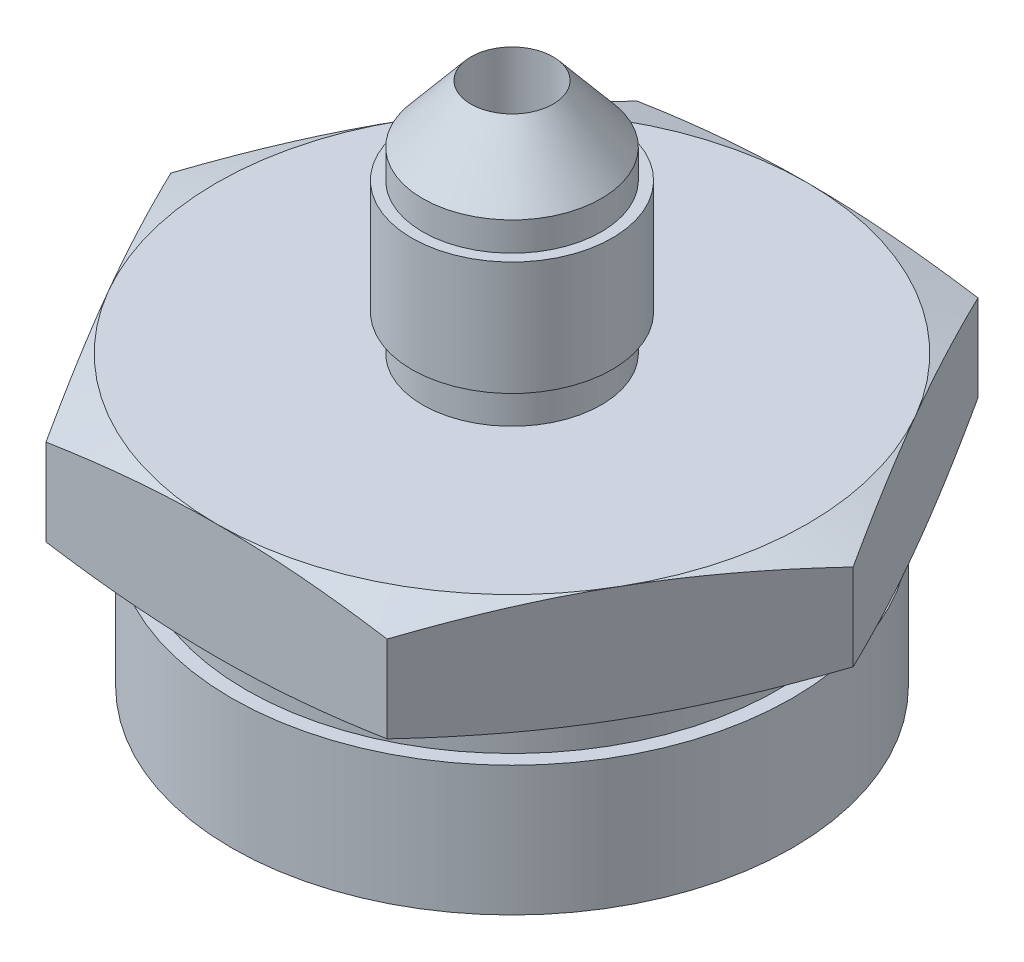
from build123d import *

# Parameters (mm, degrees)
EXTRUDE_1_DEPTH     = 20
SKETCH_3_OUTSIDE_W  = 62.49
SKETCH_3_OUTSIDE_H  = 56.148
SKETCH_3_OUTSIDE_R  = 18.45
CUT_EXTRUDE_1_DEPTH = 12
SKETCH_11_R         = 16.7
CUT_EXTRUDE_2_DEPTH = 1.5
SKETCH_13_R         = 15
CUT_EXTRUDE_4_DEPTH = 17
SKETCH_14_R         = 15.7
CUT_EXTRUDE_5_DEPTH = 13.5
SKETCH_15_W         = 1
SKETCH_15_H         = 9
SKETCH_16_R         = 6.2
EXTRUDE_2_DEPTH     = 2.5
SKETCH_17_R         = 6.95
EXTRUDE_3_DEPTH     = 7.9
SKETCH_18_R         = 6.2
EXTRUDE_4_DEPTH     = 2
SKETCH_21_R         = 2.85
CUT_EXTRUDE_6_DEPTH = 49.016073698


with BuildPart() as part:
    # Эскиз2 → Бобышка-Вытянуть1 (new body)
    with BuildSketch(Plane(origin=(0, 0, 0), x_dir=(1, 0, 0), z_dir=(0, 1, 0))):
        Polygon((11.835680518, -20.5), (23.671361037, 0), (11.835680518, 20.5), (-11.835680518, 20.5), (-23.671361037, 0), (-11.835680518, -20.5), align=None)
    extrude(amount=EXTRUDE_1_DEPTH)

    # Эскиз3 outside → Вырез-Вытянуть1 (cut)
    with BuildSketch(Plane.XZ):
        Rectangle(SKETCH_3_OUTSIDE_W, SKETCH_3_OUTSIDE_H)
        with Locations(Location((0, 0, 0), (0, 0, 270))):
            Circle(SKETCH_3_OUTSIDE_R, mode=Mode.SUBTRACT)
    extrude(amount=-CUT_EXTRUDE_1_DEPTH, mode=Mode.SUBTRACT)

    # Эскиз10 → Вырез-Повернуть1 (revolve, cut)
    with BuildSketch(Plane.XY):
        Polygon((23.671361037, 20), (23.671361037, 19), (20.5, 20), align=None)
    cut_revolve_1 = revolve(axis=Axis((0, 12, 0), (0, -1, 0)), mode=Mode.SUBTRACT)

    # Зеркальное отражение1: Вырез-Повернуть1 across plane
    add(cut_revolve_1.mirror(Plane(origin=(0, 16, 0), x_dir=(0, 0, 1), z_dir=(0, -1, 0))), mode=Mode.SUBTRACT)

    # Эскиз11 → Вырез-Вытянуть2 (cut)
    with BuildSketch(Plane.XZ):
        with Locations(Location((0, 0, 0), (0, 0, 270))):
            Circle(SKETCH_11_R)
    extrude(amount=-CUT_EXTRUDE_2_DEPTH, mode=Mode.SUBTRACT)

    # Эскиз13 → Вырез-Вытянуть4 (cut)
    with BuildSketch(Plane.XZ):
        with Locations(Location((0, 0, 0), (0, 0, 270))):
            Circle(SKETCH_13_R)
    extrude(amount=-CUT_EXTRUDE_4_DEPTH, mode=Mode.SUBTRACT)

    # Эскиз14 → Вырез-Вытянуть5 (cut)
    with BuildSketch(Plane(origin=(0, 3.5, 0), x_dir=(-1, 0, 0), z_dir=(0, -1, 0))):
        with Locations(Location((0, 0, 0), (0, 0, 90))):
            Circle(SKETCH_14_R)
    extrude(amount=-CUT_EXTRUDE_5_DEPTH, mode=Mode.SUBTRACT)

    # Эскиз15 → Повернуть1 (revolve)
    with BuildSketch(Plane.XY, mode=Mode.PRIVATE) as revolve_1_sk:
        with Locations((18.95, 4.5)):
            Rectangle(SKETCH_15_W, SKETCH_15_H)
    revolve(revolve_1_sk.sketch.rotate(Axis((0, 17, 0), (0, -1, 0)), 90), axis=Axis((0, 17, 0), (0, -1, 0)))

    # Эскиз16 → Бобышка-Вытянуть2 (add)
    with BuildSketch(Plane(origin=(0, 20, 0), x_dir=(1, 0, 0), z_dir=(0, 1, 0))):
        with Locations(Location((0, 0, 0), (0, 0, 270))):
            Circle(SKETCH_16_R)
    extrude(amount=EXTRUDE_2_DEPTH)

    # Эскиз17 → Бобышка-Вытянуть3 (add)
    with BuildSketch(Plane(origin=(0, 22.5, 0), x_dir=(1, 0, 0), z_dir=(0, 1, 0))):
        with Locations(Location((0, 0, 0), (0, 0, 270))):
            Circle(SKETCH_17_R)
    extrude(amount=EXTRUDE_3_DEPTH)

    # Эскиз18 → Бобышка-Вытянуть4 (add)
    with BuildSketch(Plane(origin=(0, 30.4, 0), x_dir=(1, 0, 0), z_dir=(0, 1, 0))):
        with Locations(Location((0, 0, 0), (0, 0, 270))):
            Circle(SKETCH_18_R)
    extrude(amount=EXTRUDE_4_DEPTH)

    # Эскиз19 → Повернуть2 (revolve)
    with BuildSketch(Plane.XY):
        Polygon((6.2, 32.4), (2.85, 36.4), (0, 36.4), (0, 32.4), align=None)
    revolve(axis=Axis((0, -964.782676563, 0), (0, 1, 0)))

    # Эскиз21 → Вырез-Вытянуть6 (cut, through all)
    with BuildSketch(Plane(origin=(0, 36.4, 0), x_dir=(1, 0, 0), z_dir=(0, 1, 0))):
        with Locations(Location((0, 0, 0), (0, 0, 180))):
            Circle(SKETCH_21_R)
    extrude(amount=-CUT_EXTRUDE_6_DEPTH, mode=Mode.SUBTRACT)

    # Эскиз22 → Вырез-Повернуть2 (revolve, cut)
    with BuildSketch(Plane.XY, mode=Mode.PRIVATE) as cut_revolve_2_sk:
        Polygon((0, 20.123304437), (5.409721973, 17), (0, 17), align=None)
    revolve(cut_revolve_2_sk.sketch.rotate(Axis((0, 17, 0), (0, 1, 0)), 180), axis=Axis((0, 17, 0), (0, 1, 0)), mode=Mode.SUBTRACT)


solid = part.part
